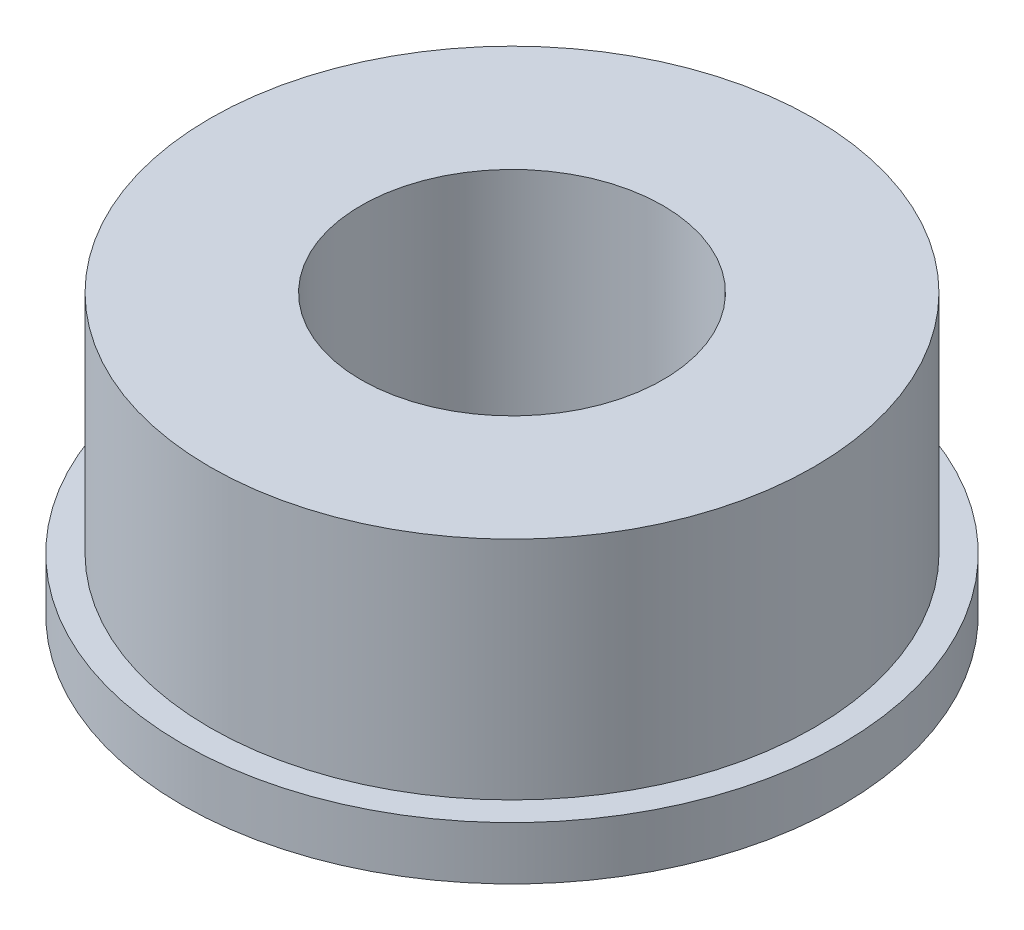
from build123d import *

# Parameters (mm, degrees)
SKETCH1_R           = 6.35
BOSS_EXTRUDE1_DEPTH = 4.7498
SKETCH2_R           = 6.9342
BOSS_EXTRUDE2_DEPTH = 1.1176
CUT_EXTRUDE1_REACH  = 13.428
SKETCH3_R           = 3.175


with BuildPart() as part:
    # Sketch1 → Boss-Extrude1 (new body)
    with BuildSketch(Plane(origin=(0, 0, 0), x_dir=(1, 0, 0), z_dir=(0, 1, 0))):
        with Locations(Location((0, 0, 0), (0, 0, 270))):
            Circle(SKETCH1_R)
    extrude(amount=BOSS_EXTRUDE1_DEPTH)

    # Sketch2 → Boss-Extrude2 (add)
    with BuildSketch(Plane.XZ):
        with Locations(Location((0, 0, 0), (0, 0, 270))):
            Circle(SKETCH2_R)
    extrude(amount=BOSS_EXTRUDE2_DEPTH)

    # Sketch3 → Cut-Extrude1 (cut, up to next)
    with BuildSketch(Plane(origin=(0, 4.7498, 0), x_dir=(1, 0, 0), z_dir=(0, 1, 0)), mode=Mode.PRIVATE) as cut_extrude1_sk1:
        with Locations(Location((0, 0, 0), (0, 0, 270))):
            Circle(SKETCH3_R)
    cut_extrude1_tool1 = extrude(cut_extrude1_sk1.sketch, amount=-CUT_EXTRUDE1_REACH, mode=Mode.PRIVATE) & part.part
    add(cut_extrude1_tool1.solids().sort_by_distance((0, 4.7498, 0))[0], mode=Mode.SUBTRACT)


solid = part.part
